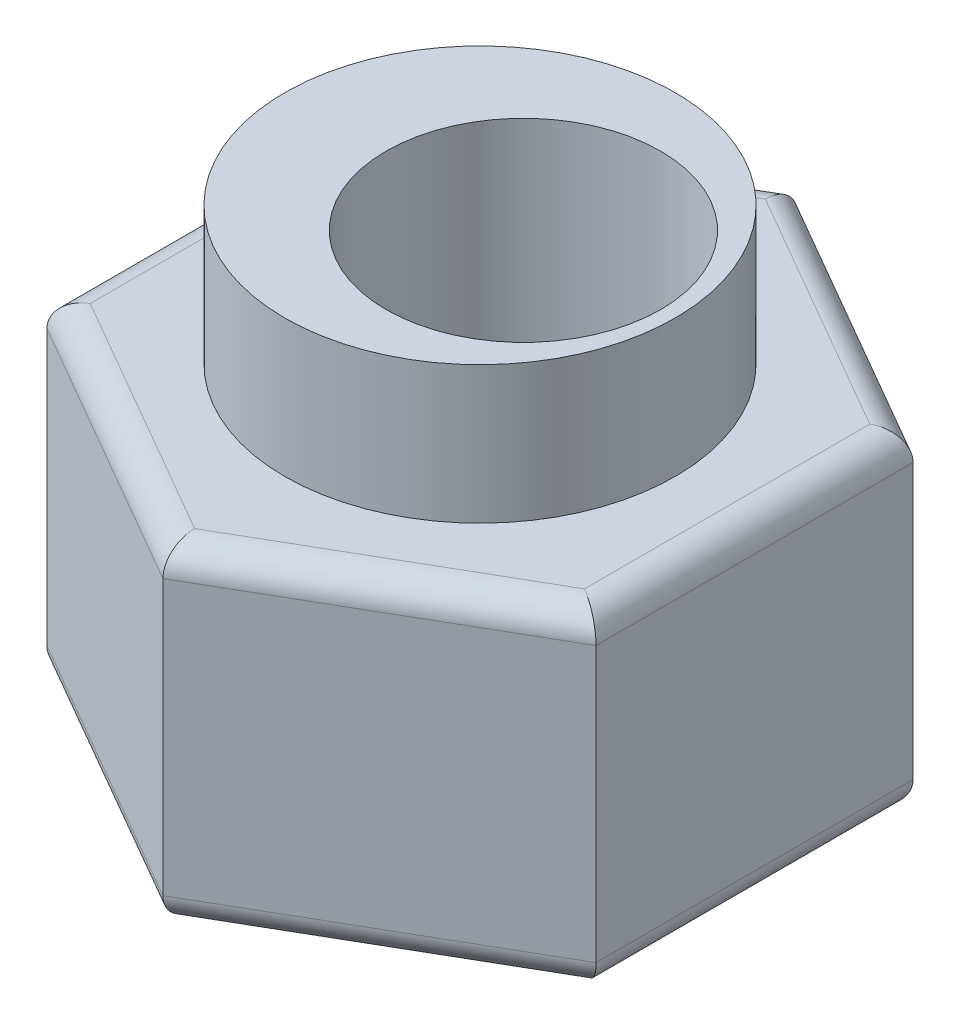
from build123d import *

# Parameters (mm, degrees)
BOSS_EXTRUDE1_DEPTH = 6
SKETCH2_R           = 3.555
BOSS_EXTRUDE2_DEPTH = 2.5
SKETCH3_R           = 2.5
CUT_EXTRUDE1_DEPTH  = 12.427306478
FILLET1_R           = 0.5


with BuildPart() as part:
    # Sketch1 → Boss-Extrude1 (new body)
    with BuildSketch(Plane(origin=(0, 0, 0), x_dir=(1, 0, 0), z_dir=(0, 1, 0))):
        Polygon((5, -2.886751346), (5, 2.886751346), (0, 5.773502692), (-5, 2.886751346), (-5, -2.886751346), (0, -5.773502692), align=None)
    extrude(amount=BOSS_EXTRUDE1_DEPTH)

    # Sketch2 → Boss-Extrude2 (add)
    with BuildSketch(Plane(origin=(0, 6, 0), x_dir=(1, 0, 0), z_dir=(0, 1, 0))):
        with Locations(Location((0, 0, 0), (0, 0, 270))):
            Circle(SKETCH2_R)
    extrude(amount=BOSS_EXTRUDE2_DEPTH)

    # Sketch3 → Cut-Extrude1 (cut, through all)
    with BuildSketch(Plane(origin=(0, 8.5, 0), x_dir=(1, 0, 0), z_dir=(0, 1, 0))):
        with Locations(Location((0.79, 0, 0), (0, 0, 270))):
            Circle(SKETCH3_R)
    extrude(amount=-CUT_EXTRUDE1_DEPTH, mode=Mode.SUBTRACT)

    # Fillet1
    fillet1_edges = [part.edges().sort_by_distance(p)[0] for p in [
        (2.5, 6, -4.330127019),
        (-2.5, 6, -4.330127019),
        (-5, 6, 0),
        (-2.5, 6, 4.330127019),
        (2.5, 6, 4.330127019),
        (-2.5, 0, 4.330127019),
        (-5, 0, 0),
        (-2.5, 0, -4.330127019),
        (2.5, 0, -4.330127019),
        (5, 0, 0),
        (2.5, 0, 4.330127019),
        (5, 6, 0),
    ]]
    fillet(fillet1_edges, radius=FILLET1_R)


solid = part.part
